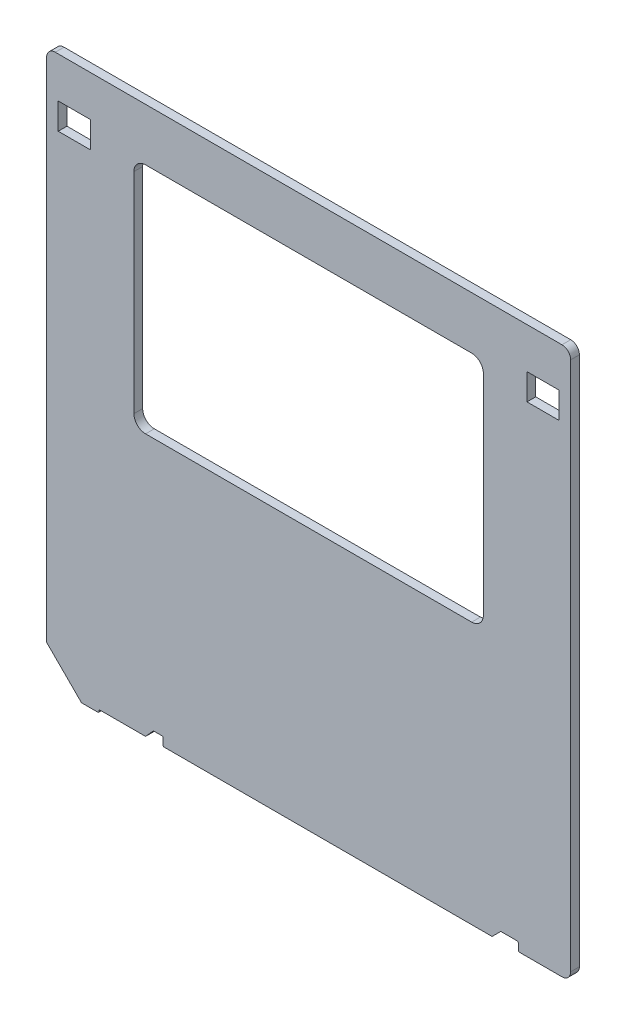
from build123d import *

# Parameters (mm, degrees)
BASE_EXTRUDE_DEPTH = 1.5
SKETCH12_W         = 5.5
SKETCH12_H         = 4.5
CUT_EXTRUDE5_DEPTH = 66.448452999
CUT_EXTRUDE7_DEPTH = 66.448452999


with BuildPart() as part:
    # Sketch1 → Base-Extrude (new body)
    with BuildSketch(Plane.XY):
        with BuildLine():
            Line((-43.5, 47), (0, 47))
            Line((0, 47), (43.5, 47))
            ThreePointArc((43.5, 47), (44.560660172, 46.560660172), (45, 45.5))
            Line((45, 45.5), (45, -45.5))
            ThreePointArc((45, -45.5), (44.560660172, -46.560660172), (43.5, -47))
            Line((43.5, -47), (36.2, -47))
            ThreePointArc((36.2, -47), (36.058578644, -46.941421356), (36, -46.8))
            Line((36, -46.8), (36, -45.7))
            ThreePointArc((36, -45.7), (35.941421356, -45.558578644), (35.8, -45.5))
            Line((35.8, -45.5), (33.082842712, -45.5))
            ThreePointArc((33.082842712, -45.5), (33.006306026, -45.515224093), (32.941421356, -45.558578644))
            Line((32.941421356, -45.558578644), (31.5, -47))
            Line((31.5, -47), (-24.8, -47))
            ThreePointArc((-24.8, -47), (-24.941421356, -46.941421356), (-25, -46.8))
            Line((-25, -46.8), (-25, -45.7))
            ThreePointArc((-25, -45.7), (-25.058578644, -45.558578644), (-25.2, -45.5))
            Line((-25.2, -45.5), (-26.661796764, -45.5))
            Line((-26.661796764, -45.5), (-28, -47))
            Line((-28, -47), (-35.8, -47))
            ThreePointArc((-35.8, -47), (-35.941421356, -47.058578644), (-36, -47.2))
            Line((-36, -47.2), (-36, -47.3))
            ThreePointArc((-36, -47.3), (-36.058578644, -47.441421356), (-36.2, -47.5))
            Line((-36.2, -47.5), (-39, -47.5))
            Line((-39, -47.5), (-45, -41.5))
            Line((-45, -41.5), (-45, 45.5))
            ThreePointArc((-45, 45.5), (-44.560660172, 46.560660172), (-43.5, 47))
        make_face()
    extrude(amount=BASE_EXTRUDE_DEPTH)

    # Sketch12 → Cut-Extrude5 (cut, through all)
    with BuildSketch(Plane.XY.offset(1.5)):
        with Locations((40.249857546, 37.75)):
            Rectangle(SKETCH12_W, SKETCH12_H)
        with Locations((-40.249857546, 37.75)):
            Rectangle(SKETCH12_W, SKETCH12_H)
    extrude(amount=-CUT_EXTRUDE5_DEPTH, mode=Mode.SUBTRACT)

    # Sketch13 → Cut-Extrude7 (cut, through all)
    with BuildSketch(Plane.XY):
        with BuildLine():
            Line((-28, 38), (28, 38))
            ThreePointArc((28, 38), (29.414213562, 37.414213562), (30, 36))
            Line((30, 36), (30, 0))
            ThreePointArc((30, 0), (29.414213562, -1.414213562), (28, -2))
            Line((28, -2), (-28, -2))
            ThreePointArc((-28, -2), (-29.414213562, -1.414213562), (-30, 0))
            Line((-30, 0), (-30, 36))
            ThreePointArc((-30, 36), (-29.414213562, 37.414213562), (-28, 38))
        make_face()
    extrude(amount=CUT_EXTRUDE7_DEPTH, mode=Mode.SUBTRACT)


solid = part.part
